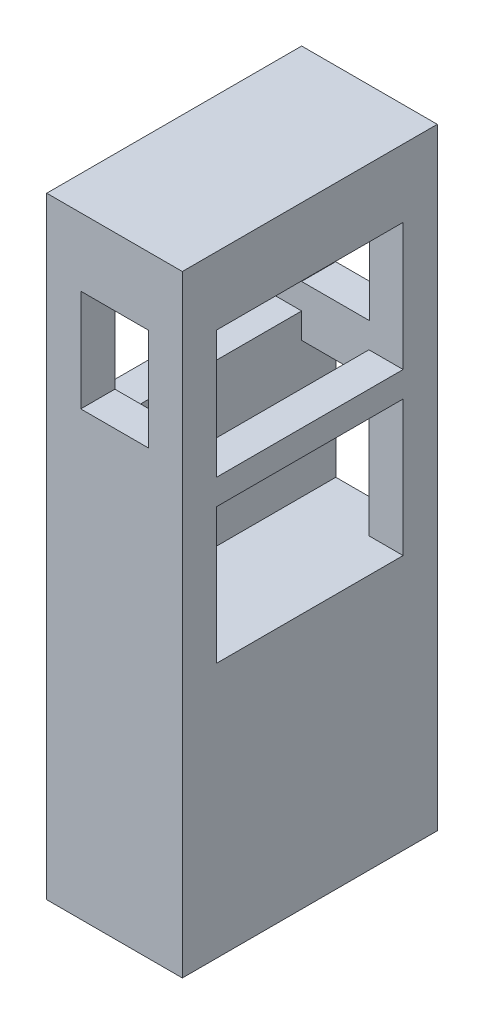
from build123d import *

# Parameters (mm, degrees)
SKETCH2_W               = 2660
SKETCH2_H               = 12000
BOSS_EXTRUDE1_DEPTH     = 5000
SKETCH3_W               = 1330
SKETCH3_H               = 2000
CUT_EXTRUDE1_DEPTH      = 5000
SKETCH4_W               = 3660
SKETCH4_H               = 2500
CUT_EXTRUDE2_DEPTH      = 13270.34813772
SKETCH6_W               = 1320
SKETCH6_H               = 3660
CUT_EXTRUDE3_DEPTH      = 2660
CUT_EXTRUDE6_DEPTH      = 13270.34813772
CUT_EXTRUDE6_DEPTH_BACK = 4269
SKETCH7_W               = 1322.5
SKETCH7_H               = 2660
SKETCH8_W               = 1322.5
SKETCH8_H               = 500
CUT_EXTRUDE7_DEPTH      = 61
SKETCH11_W              = 4269
SKETCH11_H              = 2660
BOSS_EXTRUDE2_DEPTH     = 2.5
SKETCH12_W              = 61
SKETCH12_H              = 500
BOSS_EXTRUDE3_DEPTH     = 2.5
SKETCH13_W              = 3671.651451329
SKETCH13_H              = 2660
CUT_EXTRUDE8_DEPTH      = 670
SKETCH14_W              = 670
SKETCH14_H              = 2660
BOSS_EXTRUDE4_DEPTH     = 11.651451
SKETCH16_W              = 2260
SKETCH16_H              = 3660
CUT_EXTRUDE9_DEPTH      = 1000
SKETCH17_W              = 1660
SKETCH17_H              = 4000
CUT_EXTRUDE10_DEPTH     = 4500


with BuildPart() as part:
    # Sketch2 → Boss-Extrude1 (new body)
    with BuildSketch(Plane.XY):
        with Locations((1330, 6000)):
            Rectangle(SKETCH2_W, SKETCH2_H)
    extrude(amount=BOSS_EXTRUDE1_DEPTH)

    # Sketch3 → Cut-Extrude1 (cut)
    with BuildSketch(Plane.XY.offset(5000)):
        with Locations((1332.5, 9670)):
            Rectangle(SKETCH3_W, SKETCH3_H)
    extrude(amount=-CUT_EXTRUDE1_DEPTH, mode=Mode.SUBTRACT)

    # Sketch4 → Cut-Extrude2 (cut, through all)
    with BuildSketch(Plane(origin=(2660, 0, 0), x_dir=(0, 0, -1), z_dir=(1, 0, 0))):
        with Locations((-2500, 9420)):
            Rectangle(SKETCH4_W, SKETCH4_H)
    extrude(amount=-CUT_EXTRUDE2_DEPTH, mode=Mode.SUBTRACT)

    # Sketch6 → Cut-Extrude3 (cut)
    with BuildSketch(Plane(origin=(0, 8170, 0), x_dir=(1, 0, 0), z_dir=(0, 1, 0))):
        with Locations((1330, -2500)):
            Rectangle(SKETCH6_W, SKETCH6_H)
    extrude(amount=-CUT_EXTRUDE3_DEPTH, mode=Mode.SUBTRACT)

    # Sketch7 → Cut-Extrude6 (cut, two sides: drawn at the far end of the back side and taken through both)
    with BuildSketch(Plane(origin=(0, 0, 0), x_dir=(-1, 0, 0), z_dir=(0, 0, -1)).offset(-CUT_EXTRUDE6_DEPTH_BACK)):
        with Locations((-1328.75, 6340)):
            Rectangle(SKETCH7_W, SKETCH7_H)
    extrude(amount=CUT_EXTRUDE6_DEPTH + CUT_EXTRUDE6_DEPTH_BACK, mode=Mode.SUBTRACT)

    # Sketch8 → Cut-Extrude7 (cut)
    with BuildSketch(Plane(origin=(0, 0, 4269), x_dir=(-1, 0, 0), z_dir=(0, 0, -1))):
        with Locations((-1328.75, 5260)):
            Rectangle(SKETCH8_W, SKETCH8_H)
    extrude(amount=-CUT_EXTRUDE7_DEPTH, mode=Mode.SUBTRACT)

    # Sketch11 → Boss-Extrude2 (add)
    with BuildSketch(Plane(origin=(667.5, 0, 0), x_dir=(0, 0, -1), z_dir=(1, 0, 0))):
        with Locations((-2134.5, 6340)):
            Rectangle(SKETCH11_W, SKETCH11_H)
    extrude(amount=BOSS_EXTRUDE2_DEPTH)

    # Sketch12 → Boss-Extrude3 (add)
    with BuildSketch(Plane(origin=(667.5, 0, 0), x_dir=(0, 0, -1), z_dir=(1, 0, 0))):
        with Locations((-4299.5, 5260)):
            Rectangle(SKETCH12_W, SKETCH12_H)
    extrude(amount=BOSS_EXTRUDE3_DEPTH)

    # Sketch13 → Cut-Extrude8 (cut)
    with BuildSketch(Plane(origin=(2660, 0, 0), x_dir=(0, 0, -1), z_dir=(1, 0, 0))):
        with Locations((-2505.825725665, 6340)):
            Rectangle(SKETCH13_W, SKETCH13_H)
    extrude(amount=-CUT_EXTRUDE8_DEPTH, mode=Mode.SUBTRACT)

    # Sketch14 → Boss-Extrude4 (add)
    with BuildSketch(Plane(origin=(0, 0, 4341.651451329), x_dir=(-1, 0, 0), z_dir=(0, 0, -1))):
        with Locations((-2325, 6340)):
            Rectangle(SKETCH14_W, SKETCH14_H)
    extrude(amount=BOSS_EXTRUDE4_DEPTH)

    # Sketch16 → Cut-Extrude9 (cut)
    with BuildSketch(Plane.XZ.offset(-10670)):
        with Locations((1330, 2500)):
            Rectangle(SKETCH16_W, SKETCH16_H)
    extrude(amount=-CUT_EXTRUDE9_DEPTH, mode=Mode.SUBTRACT)

    # Sketch17 → Cut-Extrude10 (cut)
    with BuildSketch(Plane.XZ):
        with Locations((1330, 2500)):
            Rectangle(SKETCH17_W, SKETCH17_H)
    extrude(amount=-CUT_EXTRUDE10_DEPTH, mode=Mode.SUBTRACT)


solid = part.part
